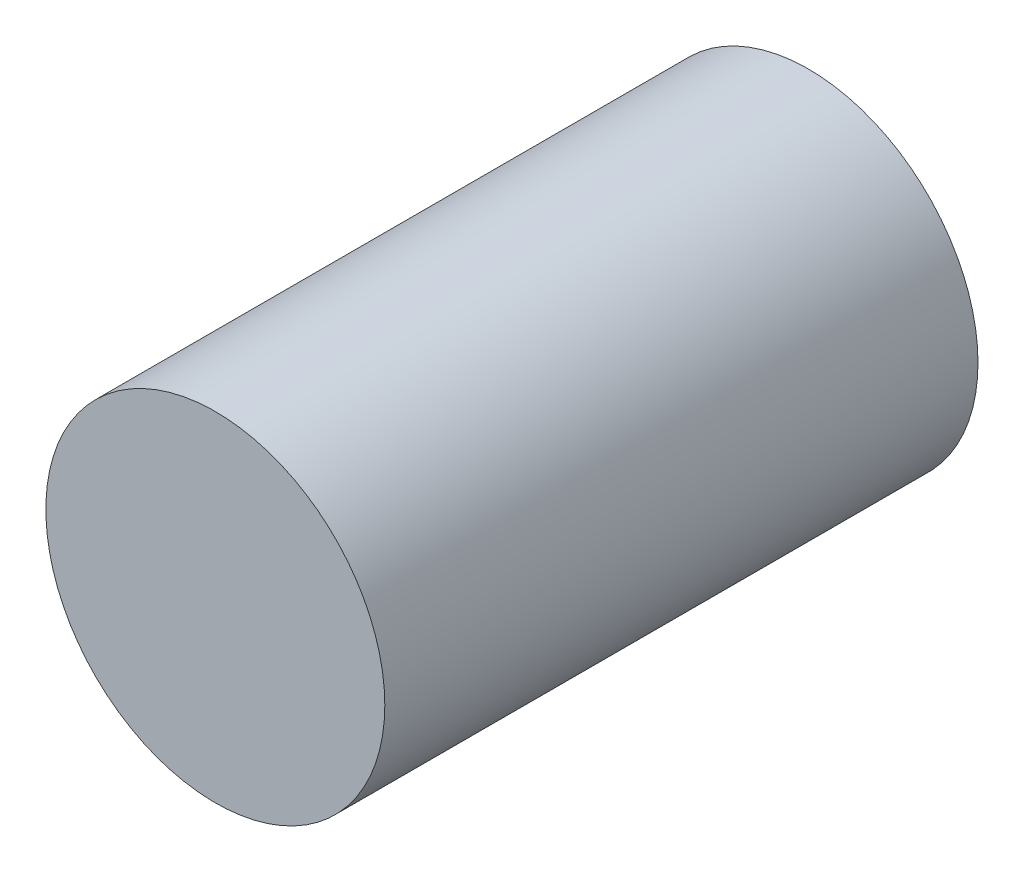
from build123d import *

# Parameters (mm, degrees)
BOSS_EXTRUDE1_START = -350
SKETCH1_R           = 200
BOSS_EXTRUDE1_DEPTH = 700


with BuildPart() as part:
    # Sketch1 → Boss-Extrude1 (new body)
    with BuildSketch(Plane.XY.offset(BOSS_EXTRUDE1_START)):
        with Locations((-400, -1650)):
            Circle(SKETCH1_R)
    extrude(amount=BOSS_EXTRUDE1_DEPTH)


solid = part.part
